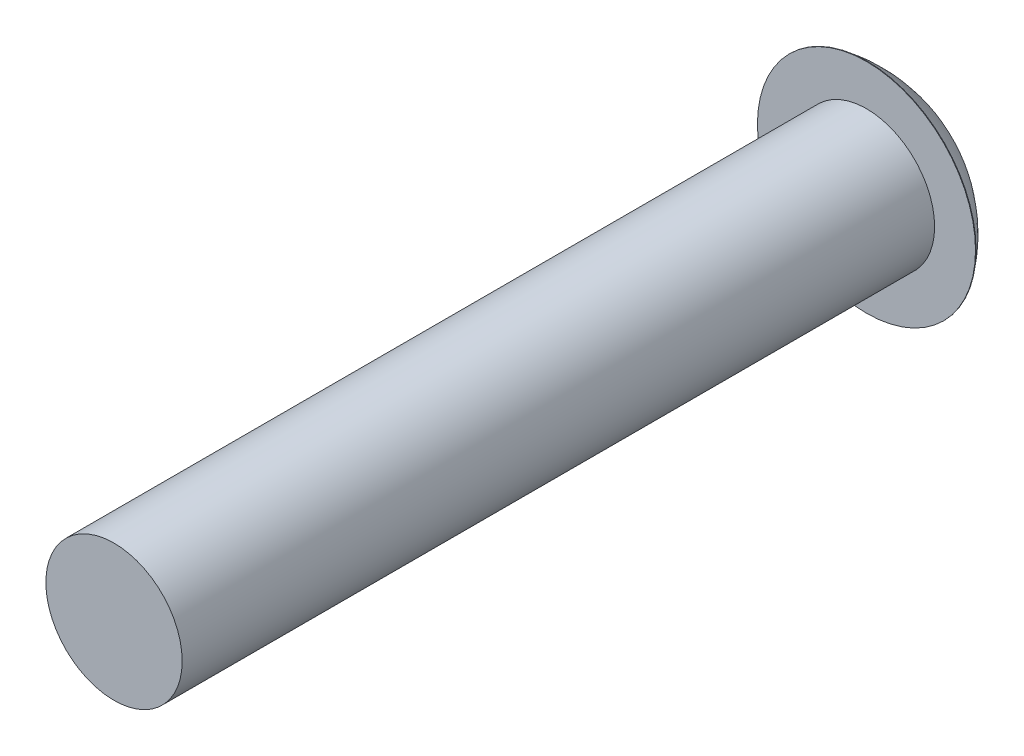
from build123d import *

# Parameters (mm, degrees)
SKETCH1_R           = 1.25
BOSS_EXTRUDE1_DEPTH = 13.8
SKETCH3_R           = 2
BOSS_EXTRUDE2_DEPTH = 0.01
DOME1_FACE_RADIUS   = 2
DOME1_HEIGHT        = 1
SCALE1_SCALE        = 1.5


with BuildPart() as part:
    # Sketch1 → Boss-Extrude1 (new body)
    with BuildSketch(Plane.XY):
        Circle(SKETCH1_R)
    extrude(amount=BOSS_EXTRUDE1_DEPTH)

    # Sketch3 → Boss-Extrude2 (add)
    with BuildSketch(Plane(origin=(0, 0, 0), x_dir=(-1, 0, 0), z_dir=(0, 0, -1))):
        with Locations(Location((0, 0, 0), (0, 0, 180))):
            Circle(SKETCH3_R)
    extrude(amount=BOSS_EXTRUDE2_DEPTH)

    # Dome1: a dome of height H over a round flat face of radius A is a cap of a sphere of radius (A * A + H * H) / (2 * H)
    dome1_r = (DOME1_FACE_RADIUS * DOME1_FACE_RADIUS + DOME1_HEIGHT * DOME1_HEIGHT) / (2 * DOME1_HEIGHT)
    dome1_base = Plane((0, 0, -0.01), z_dir=(0, 0, -1))
    with Locations(dome1_base.offset(DOME1_HEIGHT - dome1_r)):
        dome1_ball = Sphere(dome1_r, mode=Mode.PRIVATE)
    add(split(dome1_ball, bisect_by=dome1_base, keep=Keep.TOP, mode=Mode.PRIVATE))


with BuildPart() as part_1:
    # Scale1: scaled about (0, 0, 6.226948778)
    add(part.part.scale(SCALE1_SCALE).moved(Location((0, 0, -3.113474389))))


solid = part_1.part
